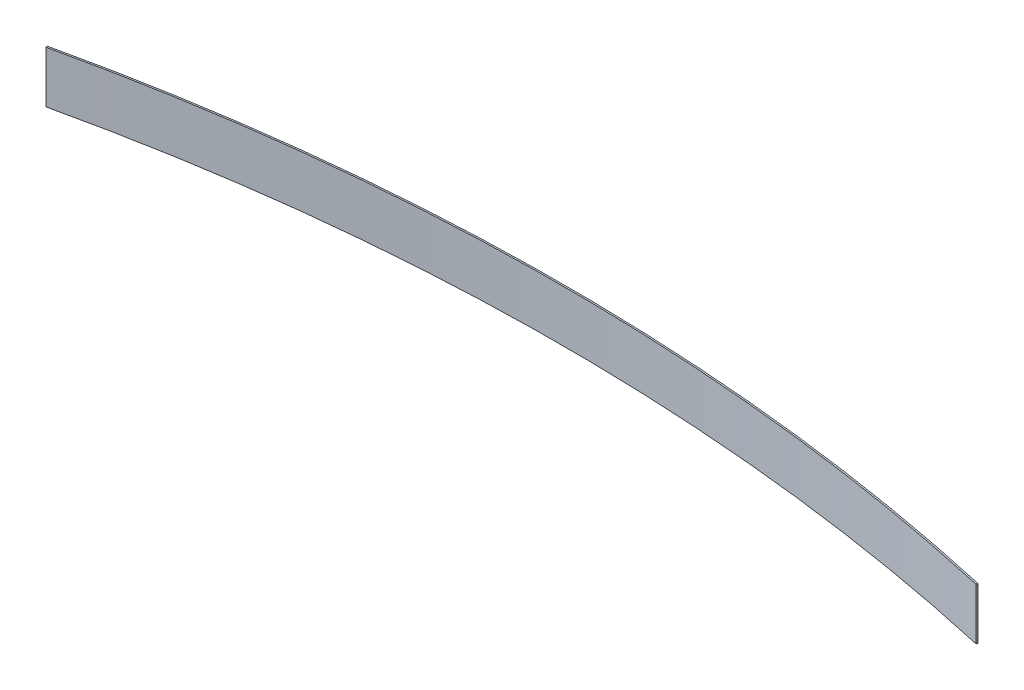
from build123d import *

# Parameters (mm, degrees)
BOSS_EXTRUDE1_DEPTH = 101.6


with BuildPart() as part:
    # Sketch1 → Boss-Extrude1 (new body)
    with BuildSketch(Plane(origin=(0, 0, 0), x_dir=(1, 0, 0), z_dir=(0, 1, 0))):
        with BuildLine():
            Line((-0.69695122, 3.097560976), (0, 0))
            ThreePointArc((0, 0), (914.4, 101.6), (1828.8, 0))
            Line((1828.8, 0), (1829.49695122, 3.097560976))
            ThreePointArc((1829.49695122, 3.097560976), (914.4, 104.775), (-0.69695122, 3.097560976))
        make_face()
    extrude(amount=BOSS_EXTRUDE1_DEPTH)


solid = part.part
